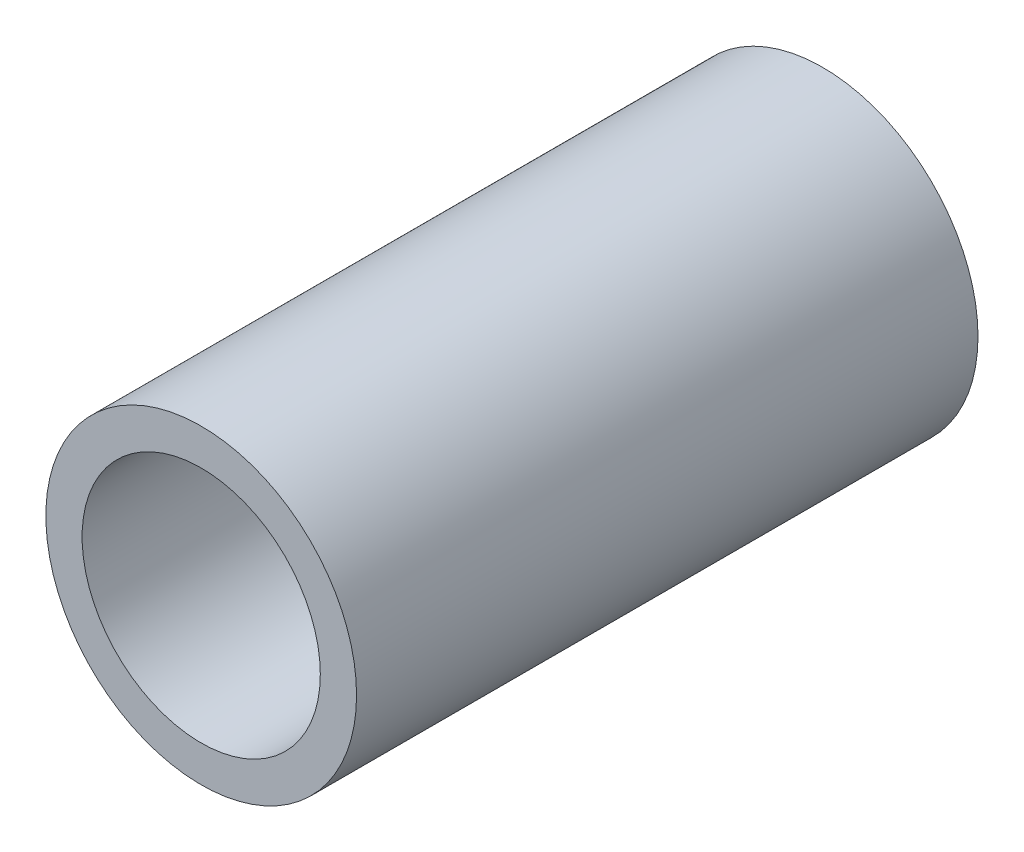
from build123d import *

# Parameters (mm, degrees)
ESBO_O1_R                = 3
RESSALTO_EXTRUS_O1_DEPTH = 12
ESBO_O2_R                = 2.3
CORTE_EXTRUS_O1_DEPTH    = 8.5
CORTE_EXTRUS_O2_REACH    = 11.5
ESBO_O3_R                = 2


with BuildPart() as part:
    # Esboço1 → Ressalto-extrusão1 (new body)
    with BuildSketch(Plane.XY):
        Circle(ESBO_O1_R)
    extrude(amount=RESSALTO_EXTRUS_O1_DEPTH)

    # Esboço2 → Corte-extrusão1 (cut)
    with BuildSketch(Plane.XY.offset(12)):
        Circle(ESBO_O2_R)
    extrude(amount=-CORTE_EXTRUS_O1_DEPTH, mode=Mode.SUBTRACT)

    # Esboço3 → Corte-extrusão2 (cut, up to next)
    with BuildSketch(Plane.XY.offset(3.5), mode=Mode.PRIVATE) as corte_extrus_o2_sk1:
        Circle(ESBO_O3_R)
    corte_extrus_o2_tool1 = extrude(corte_extrus_o2_sk1.sketch, amount=-CORTE_EXTRUS_O2_REACH, mode=Mode.PRIVATE) & part.part
    add(corte_extrus_o2_tool1.solids().sort_by_distance((0, 0, 3.5))[0], mode=Mode.SUBTRACT)


solid = part.part
